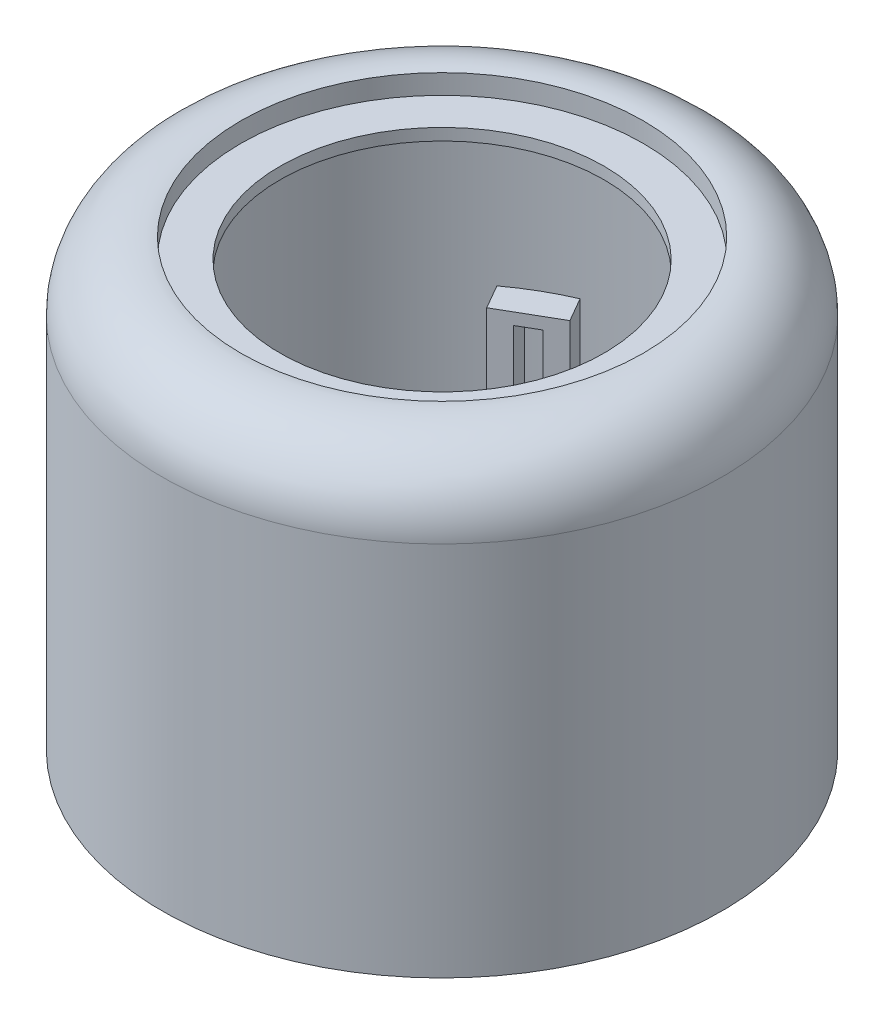
from build123d import *

# Parameters (mm, degrees)
SKETCH_5_W               = 4
SKETCH_5_H               = 2
EXTRUDE_1_DEPTH          = 22
SKETCH_6_W               = 3.5
SKETCH_6_H               = 6.2
EXTRUDE_2_DEPTH          = 1.2
CUT_EXTRUDE_1_REACH      = 62.614
CUT_EXTRUDE_1_END_RADIUS = 28.5
SKETCH_7_R               = 1.4


with BuildPart() as part:
    # 草图4 → 旋转1 (revolve)
    with BuildSketch(Plane(origin=(0, 0, 0), x_dir=(0, 0, -1), z_dir=(1, 0, 0))):
        with BuildLine():
            Line((16.5, 43.2), (16.5, 42))
            Line((16.5, 42), (22, 42))
            ThreePointArc((22, 42), (25.535533906, 40.535533906), (27, 37))
            Line((27, 37), (27, 0))
            Line((27, 0), (28.5, 0))
            Line((28.5, 0), (28.5, 38.27179677))
            ThreePointArc((28.5, 38.27179677), (26.082575695, 43.563299392), (20.5, 45.2))
            Line((20.5, 45.2), (20.5, 43.2))
            Line((20.5, 43.2), (16.5, 43.2))
        make_face()
    revolve(axis=Axis((0, 0, 0), (0, 1, 0)))

    # 草图5 → 凸台-拉伸1 (add)
    with BuildSketch(Plane.XZ):
        with Locations((26, 2.1)):
            Rectangle(SKETCH_5_W, SKETCH_5_H)
        with Locations((26, -2.1)):
            Rectangle(SKETCH_5_W, SKETCH_5_H)
        Polygon((16.684678752, -22.698711306), (14.684678752, -19.234609691), (12.952627944, -20.234609691), (14.952627944, -23.698711306), align=None)
        Polygon((13.047372056, -24.798711306), (11.315321248, -25.798711306), (9.315321248, -22.334609691), (11.047372056, -21.334609691), align=None)
        Polygon((-11.315321248, -25.798711306), (-9.315321248, -22.334609691), (-11.047372056, -21.334609691), (-13.047372056, -24.798711306), align=None)
        Polygon((-14.952627944, -23.698711306), (-16.684678752, -22.698711306), (-14.684678752, -19.234609691), (-12.952627944, -20.234609691), align=None)
        with Locations((-26, -2.1)):
            Rectangle(SKETCH_5_W, SKETCH_5_H)
        with Locations((-26, 2.1)):
            Rectangle(SKETCH_5_W, SKETCH_5_H)
        Polygon((-16.684678752, 22.698711306), (-14.684678752, 19.234609691), (-12.952627944, 20.234609691), (-14.952627944, 23.698711306), align=None)
        Polygon((-13.047372056, 24.798711306), (-11.315321248, 25.798711306), (-9.315321248, 22.334609691), (-11.047372056, 21.334609691), align=None)
        Polygon((11.315321248, 25.798711306), (9.315321248, 22.334609691), (11.047372056, 21.334609691), (13.047372056, 24.798711306), align=None)
        Polygon((14.952627944, 23.698711306), (16.684678752, 22.698711306), (14.684678752, 19.234609691), (12.952627944, 20.234609691), align=None)
    extrude(amount=-EXTRUDE_1_DEPTH)

    # 草图6 → 凸台-拉伸2 (add)
    with BuildSketch(Plane(origin=(0, 22, 0), x_dir=(1, 0, 0), z_dir=(0, 1, 0))):
        Polygon((9.315321248, -22.334609691), (11.065321248, -25.365698604), (16.434678752, -22.265698604), (14.684678752, -19.234609691), align=None)
        with Locations((25.75, 0)):
            Rectangle(SKETCH_6_W, SKETCH_6_H)
        Polygon((-14.684678752, -19.234609691), (-16.434678752, -22.265698604), (-11.065321248, -25.365698604), (-9.315321248, -22.334609691), align=None)
        with Locations((-25.75, 0)):
            Rectangle(SKETCH_6_W, SKETCH_6_H)
        Polygon((-9.315321248, 22.334609691), (-11.065321248, 25.365698604), (-16.434678752, 22.265698604), (-14.684678752, 19.234609691), align=None)
        Polygon((14.684678752, 19.234609691), (16.434678752, 22.265698604), (11.065321248, 25.365698604), (9.315321248, 22.334609691), align=None)
    extrude(amount=-EXTRUDE_2_DEPTH)

    # 切除-拉伸1: up to this cylinder (the profile starts inside it)
    cut_extrude_1_end = Plane(origin=(0, 12.2, 0), z_dir=(0, -1, 0)) * Cylinder(CUT_EXTRUDE_1_END_RADIUS, 183.228, mode=Mode.PRIVATE)
    # 草图7 → 切除-拉伸1 (cut, up to the surface)
    with BuildSketch(Plane.XY, mode=Mode.PRIVATE) as cut_extrude_1_sk1:
        with Locations((0, 12.2)):
            Circle(SKETCH_7_R)
    cut_extrude_1_tool1 = extrude(cut_extrude_1_sk1.sketch, amount=-CUT_EXTRUDE_1_REACH, mode=Mode.PRIVATE) & cut_extrude_1_end
    add(cut_extrude_1_tool1.solids().sort_by_distance((0, 12.2, 0))[0], mode=Mode.SUBTRACT)


solid = part.part
